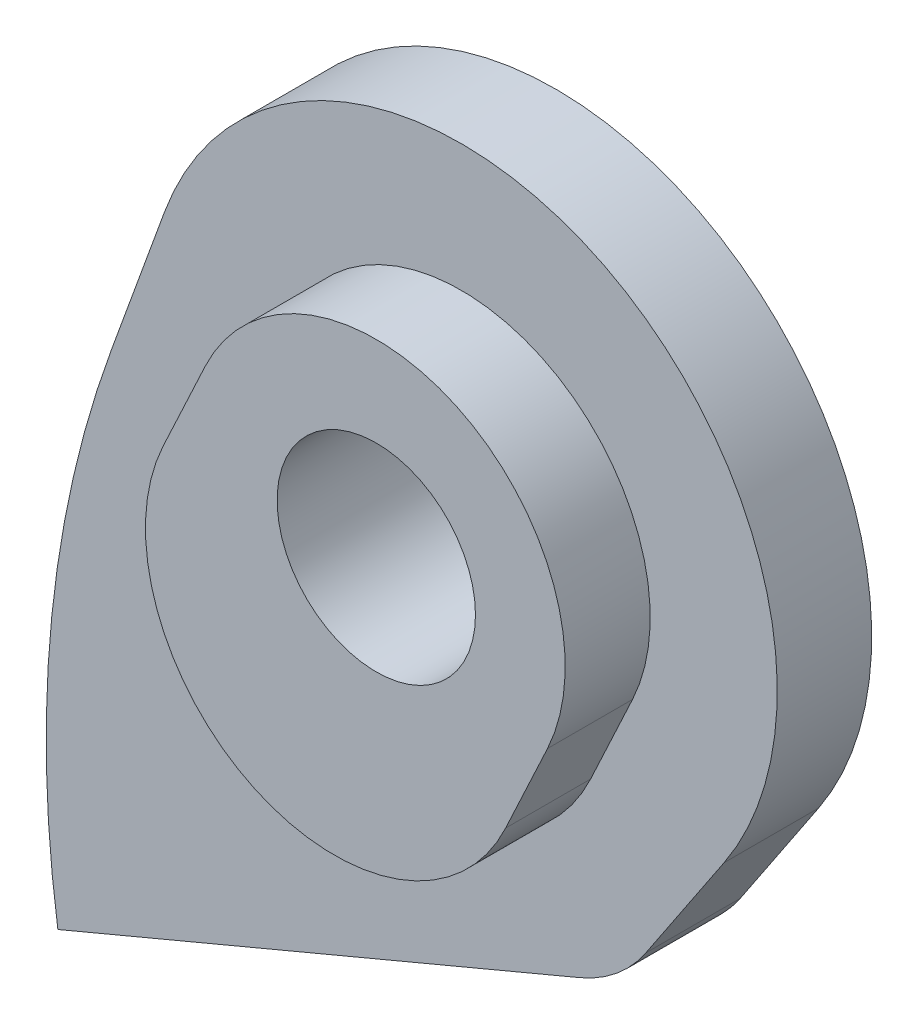
from build123d import *
from build123d.topology import SkipClean

# Parameters (mm, degrees)
SKETCH3_R           = 2.75
SKETCH3_R_2         = 2.1
BOSS_EXTRUDE2_DEPTH = 11
BOSS_EXTRUDE4_START = 2
BOSS_EXTRUDE4_DEPTH = 2
BOSS_EXTRUDE3_START = 3
BOSS_EXTRUDE3_DEPTH = 3
SKETCH14_W          = 47.285712055
SKETCH14_H          = 12.595473758
CUT_EXTRUDE1_DEPTH  = 92.326119258
BOSS_EXTRUDE5_DEPTH = 1.8
SKETCH15_R          = 2.1
CUT_EXTRUDE2_DEPTH  = 88.519372163


with BuildPart() as part:
    # Sketch3 → Boss-Extrude2 (new body)
    with BuildSketch(Plane.XY):
        with BuildLine():
            Line((11.81639044, 60.252883085), (11.728372068, 60.311638564))
            ThreePointArc((11.728372068, 60.311638564), (8.917204522, 62.7925154), (6.866230988, 65.931132995))
            ThreePointArc((6.866230988, 65.931132995), (6.025591445, 67.274340702), (4.901176311, 68.390840765))
            ThreePointArc((4.901176311, 68.390840765), (3.375934297, 70.989881123), (4.020351516, 73.93370524))
            Line((4.020351516, 73.93370524), (5.678869184, 76.41823992))
            ThreePointArc((5.678869184, 76.41823992), (3.137547336, 86.100651278), (-6.171856019, 82.420649156))
            Line((-6.171856019, 82.420649156), (-7.290261888, 79.347854286))
            ThreePointArc((-7.290261888, 79.347854286), (-8.557893098, 69.185727028), (-5.279809822, 59.483671095))
            ThreePointArc((-5.279809822, 59.483671095), (-2.848156457, 57.139360441), (0.414833066, 56.266646336))
            ThreePointArc((0.414833066, 56.266646336), (3.287818882, 55.822166382), (5.91364728, 54.574514525))
            Line((5.91364728, 54.574514525), (7.374782695, 53.599153256))
            ThreePointArc((7.374782695, 53.599153256), (10.815902262, 50.678650143), (13.499590609, 47.049812979))
            ThreePointArc((13.499590609, 47.049812979), (24.965953819, 46.665736496), (20.21385057, 57.108078892))
            ThreePointArc((20.21385057, 57.108078892), (15.833272198, 58.194897845), (11.81639044, 60.252883085))
        make_face()
        with Locations((19.351869275, 50.413343031)):
            Circle(SKETCH3_R, mode=Mode.SUBTRACT)
        with Locations((0.471910886, 63.016405008)):
            Circle(SKETCH3_R, mode=Mode.SUBTRACT)
        with Locations((0.114687614, 80.132534397)):
            Circle(SKETCH3_R_2, mode=Mode.SUBTRACT)
    extrude(amount=BOSS_EXTRUDE2_DEPTH)

    # Sketch13 → Boss-Extrude4 (add)
    with SkipClean():  # the faces are left unmerged after this step: merging them gives an invalid solid
        with BuildSketch(Plane(origin=(0, 0, 0), x_dir=(-1, 0, 0), z_dir=(0, 0, -1)).offset(BOSS_EXTRUDE4_START)):
            with BuildLine():
                Line((-5.678869184, 76.41823992), (-4.020351516, 73.93370524))
                ThreePointArc((-4.020351516, 73.93370524), (-3.407782277, 73.255690271), (-2.625844204, 72.782913134))
                Line((-2.625844204, 72.782913134), (8.427696777, 68.139691908))
                ThreePointArc((8.427696777, 68.139691908), (8.557268078, 73.814637343), (7.290261888, 79.347854286))
                Line((7.290261888, 79.347854286), (6.171856019, 82.420649156))
                ThreePointArc((6.171856019, 82.420649156), (-3.137547336, 86.100651278), (-5.678869184, 76.41823992))
            make_face()
        extrude(amount=-BOSS_EXTRUDE4_DEPTH)

    # Sketch12 → Boss-Extrude3 (add)
    with SkipClean():  # the faces are left unmerged after this step: merging them gives an invalid solid
        with BuildSketch(Plane(origin=(0, 0, -2), x_dir=(-1, 0, 0), z_dir=(0, 0, -1)).offset(BOSS_EXTRUDE3_START)):
            with BuildLine():
                Line((8.013597957, 76.965805827), (4.924247842, 69.611373108))
                Line((4.924247842, 69.611373108), (8.427696777, 68.139691908))
                ThreePointArc((8.427696777, 68.139691908), (8.649339764, 72.572862025), (8.013597957, 76.965805827))
            make_face()
        extrude(amount=-BOSS_EXTRUDE3_DEPTH)

    # Sketch14 → Cut-Extrude1 (cut, through all)
    with BuildSketch(Plane(origin=(0, 0, 0), x_dir=(1, 0, 0), z_dir=(0, 1, 0))):
        with Locations((8.412006537, -6.297736879)):
            Rectangle(SKETCH14_W, SKETCH14_H)
    extrude(amount=CUT_EXTRUDE1_DEPTH, mode=Mode.SUBTRACT)

    # Sketch16 → Boss-Extrude5 (add)
    with BuildSketch(Plane.XY):
        with BuildLine():
            Line((3.739918762, 78.44206135), (2.852420412, 76.538814997))
            ThreePointArc((2.852420412, 76.538814997), (-2.463283783, 74.604056896), (-4.398041884, 79.919761091))
            Line((-4.398041884, 79.919761091), (-3.510543534, 81.823007444))
            ThreePointArc((-3.510543534, 81.823007444), (1.805160661, 83.757765545), (3.739918762, 78.44206135))
        make_face()
    extrude(amount=BOSS_EXTRUDE5_DEPTH)

    # Sketch15 → Cut-Extrude2 (cut, through all)
    with BuildSketch(Plane.XY.offset(1.8)):
        with Locations((0.114687614, 80.132534397)):
            Circle(SKETCH15_R)
    extrude(amount=-CUT_EXTRUDE2_DEPTH, mode=Mode.SUBTRACT)


solid = part.part
